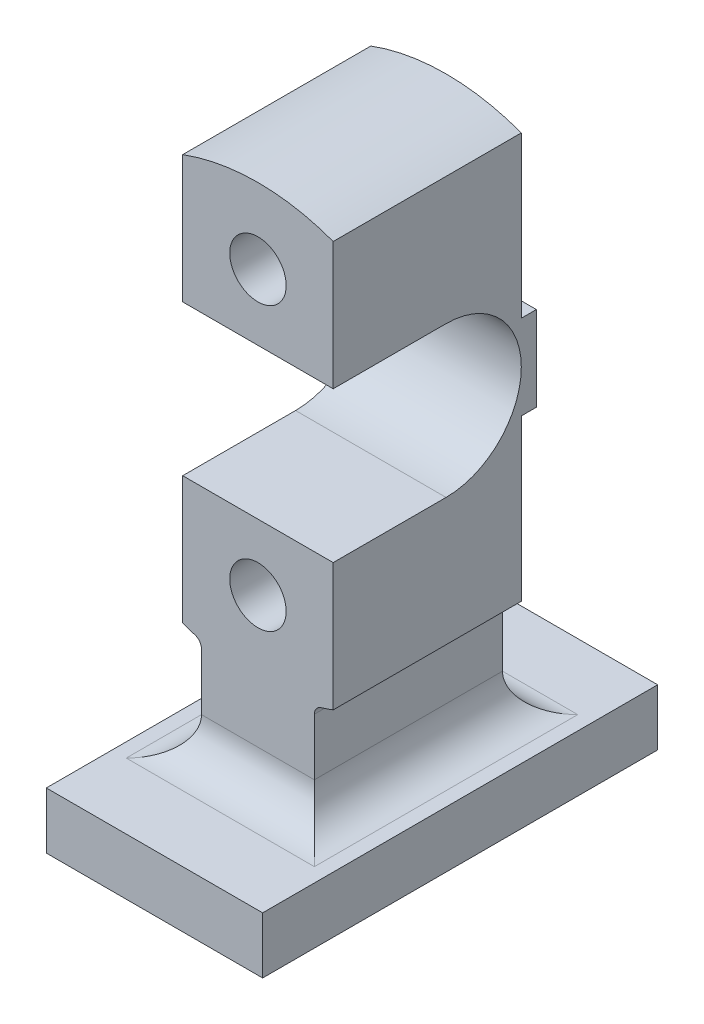
from build123d import *

# Parameters (mm, degrees)
SKETCH2_R           = 15
BOSS_EXTRUDE2_DEPTH = 210
SKETCH7_OUTSIDE_W   = 290.34
SKETCH7_OUTSIDE_H   = 390.34
SKETCH7_OUTSIDE_W_2 = 100
SKETCH7_OUTSIDE_H_2 = 289.924440787
CUT_EXTRUDE3_DEPTH  = 376.008333241
BOSS_EXTRUDE6_START = -17.5
SKETCH8_W           = 210
SKETCH8_H           = 30
BOSS_EXTRUDE6_DEPTH = 115
FILLET2_R           = 20
SKETCH9_W           = 8
SKETCH9_H           = 45
BOSS_EXTRUDE7_DEPTH = 80
CUT_EXTRUDE4_DEPTH  = 376.008333241


with BuildPart() as part:
    # Sketch2 → Boss-Extrude2 (new body)
    with BuildSketch(Plane.XY):
        with BuildLine():
            Line((-30, 65.217597168), (-30, 15))
            Line((-30, 15), (-57.5, 15))
            Line((-57.5, 15), (-57.5, -15))
            Line((-57.5, -15), (57.5, -15))
            Line((57.5, -15), (57.5, 15))
            Line((57.5, 15), (30, 15))
            Line((30, 15), (30, 65.217597168))
            ThreePointArc((30, 65.217597168), (30.981812183, 68.193192346), (33.541666667, 70.000197286))
            ThreePointArc((33.541666667, 70.000197286), (36.786992802, 71.042590153), (40, 72.180706736))
            Line((40, 72.180706736), (40, 287.819293264))
            ThreePointArc((40, 287.819293264), (0, 295), (-40, 287.819293264))
            Line((-40, 287.819293264), (-40, 72.180706736))
            ThreePointArc((-40, 72.180706736), (-36.786992802, 71.042590153), (-33.541666667, 70.000197286))
            ThreePointArc((-33.541666667, 70.000197286), (-30.981812183, 68.193192346), (-30, 65.217597168))
        make_face()
        with Locations((0, 105)):
            Circle(SKETCH2_R, mode=Mode.SUBTRACT)
        with Locations((0, 255)):
            Circle(SKETCH2_R, mode=Mode.SUBTRACT)
    extrude(amount=-BOSS_EXTRUDE2_DEPTH)

    # Sketch7 outside → Cut-Extrude3 (cut, through all)
    with BuildSketch(Plane(origin=(40, 0, 0), x_dir=(0, 0, -1), z_dir=(1, 0, 0))):
        with Locations((105, 140)):
            Rectangle(SKETCH7_OUTSIDE_W, SKETCH7_OUTSIDE_H)
        with Locations((105, 159.962220394)):
            Rectangle(SKETCH7_OUTSIDE_W_2, SKETCH7_OUTSIDE_H_2, mode=Mode.SUBTRACT)
    extrude(amount=-CUT_EXTRUDE3_DEPTH, mode=Mode.SUBTRACT)


with BuildPart() as cut_extrude3_piece_1:
    # of the separate pieces the step leaves, piece 1, a body of its own (cut_extrude3_pieces)
    add(part.part.solids().sort_by_distance((-40, 72.180706736, -55))[0])



with BuildPart() as cut_extrude3_piece_2:
    # of the separate pieces the step leaves, piece 2, a body of its own (cut_extrude3_pieces)
    add(part.part.solids().sort_by_distance((40, -15, 0))[0])


with BuildPart() as cut_extrude3_piece_1_1:
    add(cut_extrude3_piece_1.part)

    add(cut_extrude3_piece_2.part)  # Boss-Extrude6 merges Cut-Extrude3 piece 2
    # Sketch8 → Boss-Extrude6 (add)
    with BuildSketch(Plane.ZY.offset(-40).offset(BOSS_EXTRUDE6_START)):
        with Locations((-105, 0)):
            Rectangle(SKETCH8_W, SKETCH8_H)
    extrude(amount=BOSS_EXTRUDE6_DEPTH)

    # Fillet2
    fillet2_edges = [cut_extrude3_piece_1_1.edges().sort_by_distance(p)[0] for p in [
        (-30, 15, -105),
        (0, 15, -55),
        (0, 15, -155),
        (30, 15, -105),
    ]]
    fillet(fillet2_edges, radius=FILLET2_R)

    # Sketch9 → Boss-Extrude7 (add)
    with BuildSketch(Plane(origin=(40, 0, 0), x_dir=(0, 0, -1), z_dir=(1, 0, 0))):
        with Locations((159, 180)):
            Rectangle(SKETCH9_W, SKETCH9_H)
    extrude(amount=-BOSS_EXTRUDE7_DEPTH)

    # Sketch10 → Cut-Extrude4 (cut, through all)
    with BuildSketch(Plane(origin=(40, 0, 0), x_dir=(0, 0, -1), z_dir=(1, 0, 0))):
        with BuildLine():
            Line((115, 220), (55, 220))
            Line((55, 220), (55, 140))
            Line((55, 140), (115, 140))
            ThreePointArc((115, 140), (155, 180), (115, 220))
        make_face()
    extrude(amount=-CUT_EXTRUDE4_DEPTH, mode=Mode.SUBTRACT)


solid = cut_extrude3_piece_1_1.part
